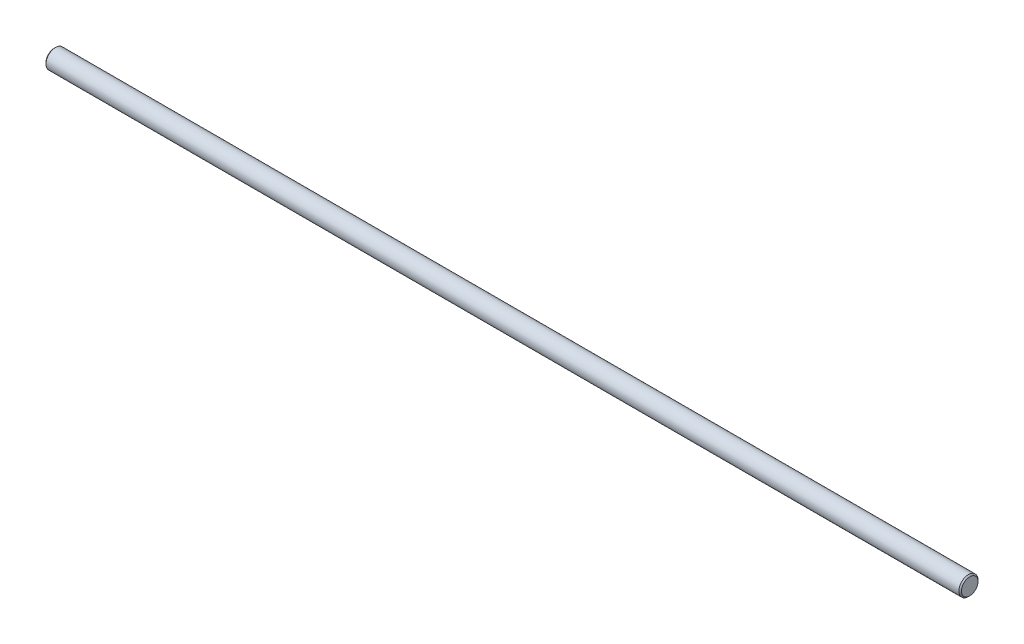
from build123d import *

# Parameters (mm, degrees)
EXTRUDE1_DEPTH      = 228.6
EXTRUDE1_DEPTH_BACK = 228.6
SKETCH2_R           = 4.7625
CHAMFER1_SIZE       = 0.635


with BuildPart() as part:
    # Sketch2 → Extrude1 (new, two sides: drawn at the far end of the back side and taken through both)
    with BuildSketch(Plane(origin=(0, 0, 0), x_dir=(0, 0, -1), z_dir=(1, 0, 0)).offset(-EXTRUDE1_DEPTH_BACK)):
        Circle(SKETCH2_R)
    extrude(amount=EXTRUDE1_DEPTH + EXTRUDE1_DEPTH_BACK)

    # Chamfer1
    chamfer1_edges = [part.edges().sort_by_distance(p)[0] for p in [
        (-228.6, 0, 4.7625),
        (228.6, 0, 4.7625),
    ]]
    chamfer(chamfer1_edges, length=CHAMFER1_SIZE)


solid = part.part
